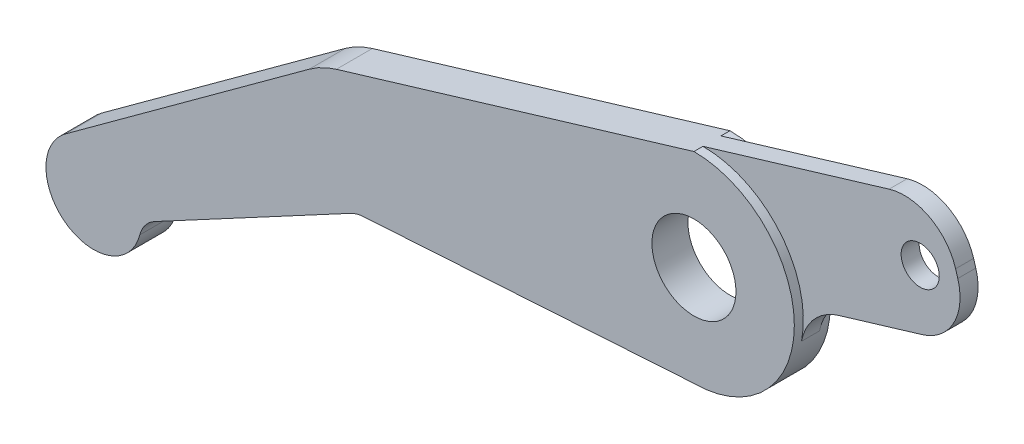
from build123d import *

# Parameters (mm, degrees)
SKETCH1_R           = 14
BOSS_EXTRUDE1_DEPTH = 12
BOSS_EXTRUDE2_DEPTH = 9
FILLET1_R           = 17.78
CUT_EXTRUDE2_START  = -3
CUT_EXTRUDE2_DEPTH  = 3


with BuildPart() as part:
    # Sketch1 → Boss-Extrude1 (new body)
    with BuildSketch(Plane.XY):
        with BuildLine():
            Line((-96.91554928, -1.121955778), (-15.722399936, 58.140946839))
            ThreePointArc((-15.722399936, 58.140946839), (-11.394783315, 60.770107897), (-6.686327841, 62.633223709))
            Line((-6.686327841, 62.633223709), (112.446127039, 98.471593282))
            ThreePointArc((112.446127039, 98.471593282), (145.896391136, 65.021329185), (112.446127039, 31.571065087))
            Line((112.446127039, 31.571065087), (2.176317829, 24.613004518))
            ThreePointArc((2.176317829, 24.613004518), (0.064344939, 24.249840519), (-1.921888512, 23.445356673))
            Line((-1.921888512, 23.445356673), (-67.204247556, -11.552416003))
            ThreePointArc((-67.204247556, -11.552416003), (-70.352621766, -14.199342537), (-72.170382748, -17.889088499))
            ThreePointArc((-72.170382748, -17.889088499), (-96.461185182, -27.094594937), (-96.91554928, -1.121955778))
        make_face()
        with Locations((112.446127039, 65.021329185)):
            Circle(SKETCH1_R, mode=Mode.SUBTRACT)
    extrude(amount=-BOSS_EXTRUDE1_DEPTH)

    # Sketch2 → Boss-Extrude2 (add)
    with BuildSketch(Plane.XY):
        with BuildLine():
            Line((179.335031787, 118.593643911), (112.446127039, 98.471593282))
            ThreePointArc((112.446127039, 98.471593282), (134.765386203, 89.936602382), (145.694919218, 68.687115155))
            Line((145.694919218, 68.687115155), (190.310695767, 82.108786775))
            Line((190.310695767, 82.108786775), (186.652141107, 94.270405821))
            ThreePointArc((186.652141107, 94.270405821), (178.742054254, 98.521938013), (182.993586447, 106.432024866))
            Line((182.993586447, 106.432024866), (179.335031787, 118.593643911))
        make_face()
        with BuildLine():
            Line((191.496650832, 122.252198571), (179.335031787, 118.593643911))
            Line((179.335031787, 118.593643911), (182.993586447, 106.432024866))
            ThreePointArc((182.993586447, 106.432024866), (188.611437978, 105.447214315), (191.172863777, 100.351215343))
            ThreePointArc((191.172863777, 100.351215343), (189.918862749, 96.562641142), (186.652141107, 94.270405821))
            Line((186.652141107, 94.270405821), (190.310695767, 82.108786775))
            Line((190.310695767, 82.108786775), (202.472314812, 85.767341435))
            Line((202.472314812, 85.767341435), (191.496650832, 122.252198571))
        make_face()
    extrude(amount=-BOSS_EXTRUDE2_DEPTH)

    # Fillet1
    fillet1_edges = [part.edges().sort_by_distance(p)[0] for p in [
        (191.496650832, 122.252198571, -4.5),
        (202.472314812, 85.767341435, -4.5),
        (145.694919218, 68.687115155, -4.5),
    ]]
    fillet(fillet1_edges, radius=FILLET1_R)

    # Sketch4 → Cut-Extrude2 (cut)
    with BuildSketch(Plane.XY.offset(CUT_EXTRUDE2_START)):
        with BuildLine():
            Line((174.470384169, 117.130222047), (112.446127039, 98.471593282))
            ThreePointArc((112.446127039, 98.471593282), (138.257160255, 86.298329266), (145.281823298, 58.638757657))
            ThreePointArc((145.281823298, 58.638757657), (149.548777584, 67.172961066), (157.613182204, 72.272461516))
            Line((157.613182204, 72.272461516), (185.446048149, 80.645364911))
            ThreePointArc((185.446048149, 80.645364911), (195.985244574, 89.254027292), (197.350338288, 102.793608099))
            Line((197.350338288, 102.793608099), (196.618627356, 105.225931908))
            ThreePointArc((196.618627356, 105.225931908), (188.009964976, 115.765128333), (174.470384169, 117.130222047))
        make_face()
    extrude(amount=CUT_EXTRUDE2_DEPTH, mode=Mode.SUBTRACT)


solid = part.part
